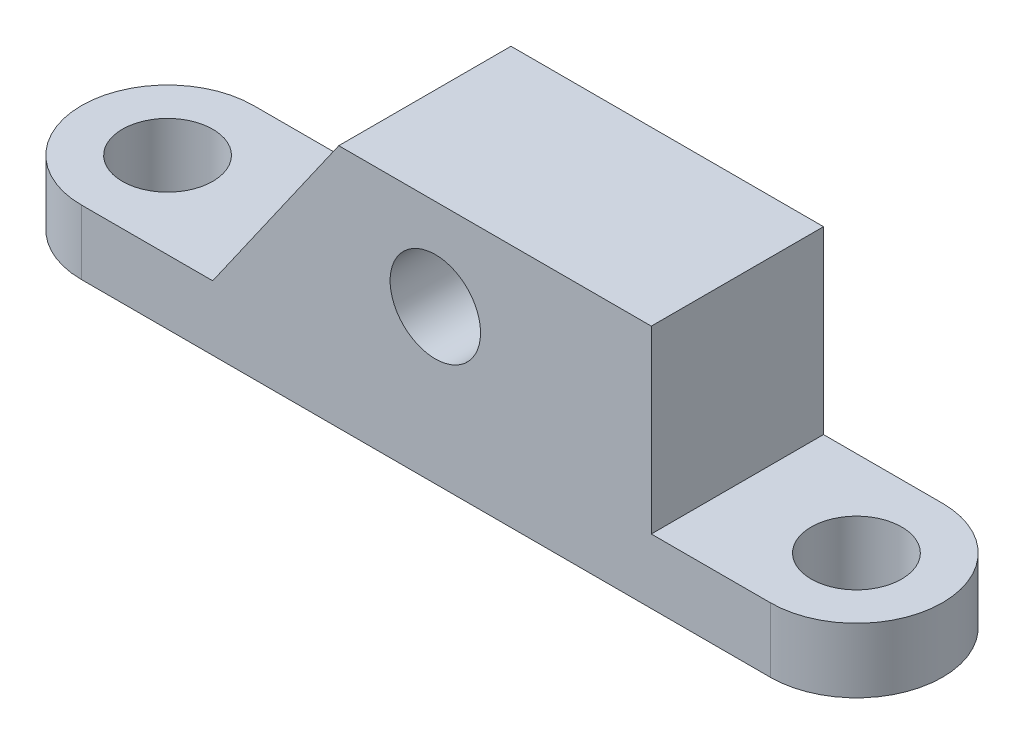
from build123d import *

# Parameters (mm, degrees)
SKETCH1_R           = 2.1
BOSS_EXTRUDE1_DEPTH = 3
SKETCH2_R           = 2.1
BOSS_EXTRUDE2_DEPTH = 8


with BuildPart() as part:
    # Sketch1 → Boss-Extrude1 (new body)
    with BuildSketch(Plane(origin=(0, 0, 0), x_dir=(1, 0, 0), z_dir=(0, 1, 0))):
        with BuildLine():
            Line((0, -4), (32, -4))
            ThreePointArc((32, -4), (36, 0), (32, 4))
            Line((32, 4), (0, 4))
            ThreePointArc((0, 4), (-4, 0), (0, -4))
        make_face()
        with Locations(Location((0, 0, 0), (0, 0, 270))):
            Circle(SKETCH1_R, mode=Mode.SUBTRACT)
        with Locations(Location((32, 0, 0), (0, 0, 270))):
            Circle(SKETCH1_R, mode=Mode.SUBTRACT)
    extrude(amount=BOSS_EXTRUDE1_DEPTH)

    # Sketch2 → Boss-Extrude2 (add)
    with BuildSketch(Plane.XY.offset(4)):
        Polygon((26.470573602, 11.363168568), (11.952968187, 11.363168568), (6.097014513, 3), (20.614619928, 3), (26.470573602, 3), align=None)
        with Locations((16.438382798, 7.127099025)):
            Circle(SKETCH2_R, mode=Mode.SUBTRACT)
    extrude(amount=-BOSS_EXTRUDE2_DEPTH)


solid = part.part
